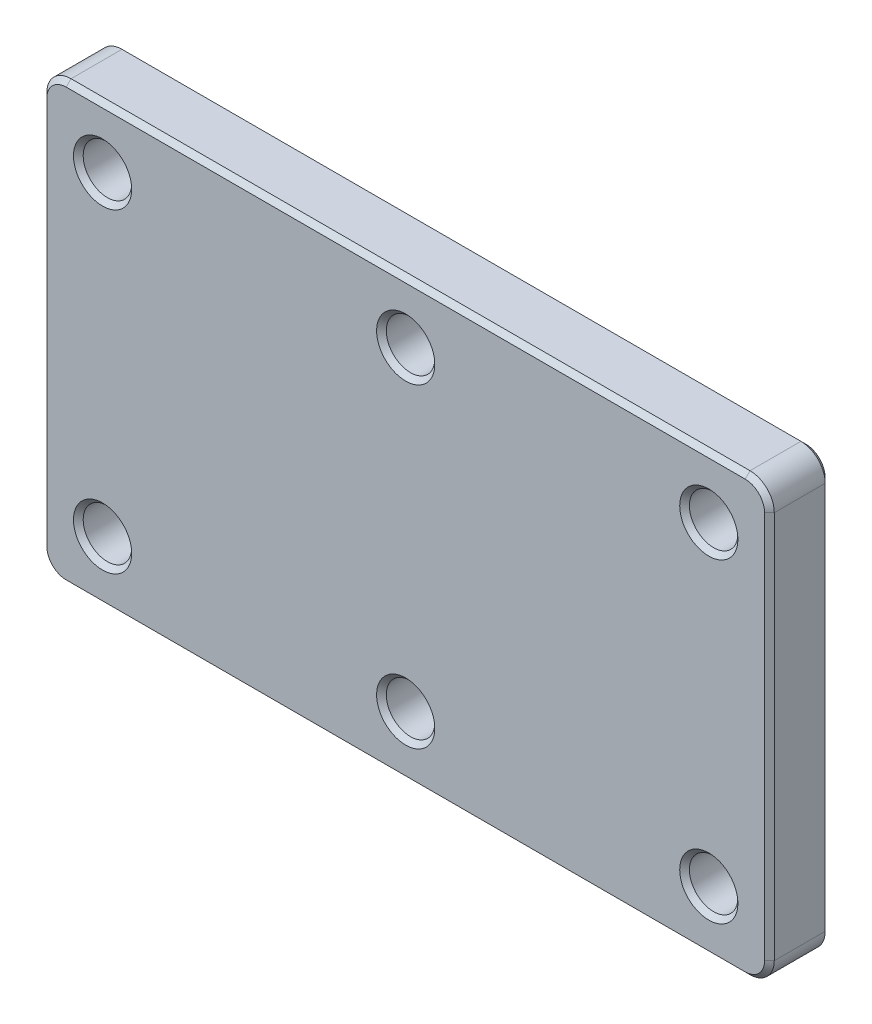
from build123d import *

# Parameters (mm, degrees)
SKETCH_1_W      = 300
SKETCH_1_H      = 180
EXTRUDE_1_DEPTH = 25
FILLET_1_R      = 10
F_20_0MM_1_D    = 20
CHAMFER_1_SIZE  = 2


with BuildPart() as part:
    # 草圖1 → 填料-伸長1 (new body)
    with BuildSketch(Plane.XY):
        with Locations((150, 90)):
            Rectangle(SKETCH_1_W, SKETCH_1_H)
    extrude(amount=EXTRUDE_1_DEPTH)

    # 圓角1
    fillet_1_edges = [part.edges().sort_by_distance(p)[0] for p in [
        (0, 180, 12.5),
        (300, 180, 12.5),
        (300, 0, 12.5),
        (0, 0, 12.5),
    ]]
    fillet(fillet_1_edges, radius=FILLET_1_R)

    # Ø20.0mm 定位孔1 (through all)
    with Locations(Plane.XY.offset(25)):
        with Locations((25, 155), (25, 25), (150, 25), (150, 155), (275, 155), (275, 25)):
            Hole(F_20_0MM_1_D / 2)

    # 導角1
    chamfer_1_edges = [part.edges().sort_by_distance(p)[0] for p in [
        (300, 90, 0),
        (300, 90, 25),
        (0, 90, 0),
        (150, 180, 0),
        (150, 0, 0),
        (2.928932188, 177.071067812, 0),
        (297.071067812, 177.071067812, 0),
        (2.928932188, 2.928932188, 0),
        (297.071067812, 2.928932188, 0),
        (150, 0, 25),
        (0, 90, 25),
        (150, 180, 25),
        (2.928932188, 177.071067812, 25),
        (297.071067812, 177.071067812, 25),
        (2.928932188, 2.928932188, 25),
        (297.071067812, 2.928932188, 25),
        (285, 25, 25),
        (285, 25, 0),
        (285, 155, 25),
        (285, 155, 0),
        (160, 155, 25),
        (160, 155, 0),
        (160, 25, 25),
        (160, 25, 0),
        (35, 25, 25),
        (35, 25, 0),
        (35, 155, 25),
        (35, 155, 0),
    ]]
    chamfer(chamfer_1_edges, length=CHAMFER_1_SIZE)


solid = part.part
